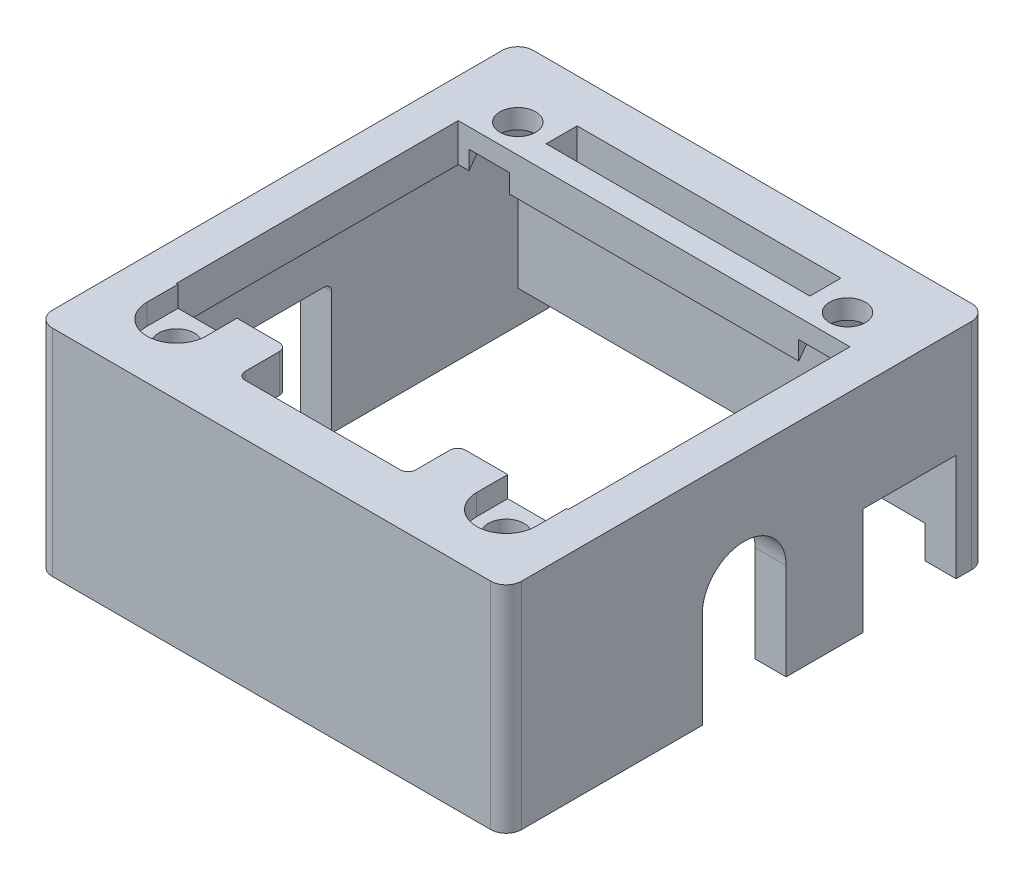
from build123d import *

# Parameters (mm, degrees)
SKETCH_1_W           = 30.25
SKETCH_1_H           = 31
SKETCH_1_W_2         = 26.25
SKETCH_1_H_2         = 27
EXTRUDE_1_DEPTH      = 11.42
SKETCH_2_W           = 30.25
SKETCH_2_H           = 31
EXTRUDE_2_DEPTH      = 2.45
SKETCH_3_W           = 25.25
SKETCH_3_H           = 18.16
CUT_EXTRUDE_1_DEPTH  = 2.45
SKETCH_4_R           = 1.15
CUT_EXTRUDE_3_DEPTH  = 2.45
CUT_EXTRUDE_4_DEPTH  = 1.2
SKETCH_6_R           = 1.9
CUT_EXTRUDE_5_DEPTH  = 1.35
SKETCH_7_W           = 11
SKETCH_7_H           = 3.2
CUT_EXTRUDE_7_DEPTH  = 2.45
SKETCH_8_W           = 17
SKETCH_8_H           = 2
CUT_EXTRUDE_9_DEPTH  = 2.45
FILLET_1_R           = 1
SKETCH_12_W          = 6
SKETCH_12_H          = 6.9
CUT_EXTRUDE_10_DEPTH = 2
CUT_EXTRUDE_11_DEPTH = 2
SKETCH_15_W          = 9.5
SKETCH_15_H          = 8.4
CUT_EXTRUDE_12_DEPTH = 2
FILLET_2_R           = 0.5
FILLET_3_R           = 0.5
CUT_EXTRUDE_19_REACH = 36.644
SKETCH_17_W          = 26.25
SKETCH_17_H          = 2.1
SKETCH_18_W          = 3.8
SKETCH_18_H          = 2
CUT_EXTRUDE_20_DEPTH = 1.35


with BuildPart() as part:
    # 草图1 → 凸台-拉伸1 (new body)
    with BuildSketch(Plane(origin=(0, 0, 0), x_dir=(1, 0, 0), z_dir=(0, 1, 0))):
        Rectangle(SKETCH_1_W, SKETCH_1_H)
        Rectangle(SKETCH_1_W_2, SKETCH_1_H_2, mode=Mode.SUBTRACT)
    extrude(amount=-EXTRUDE_1_DEPTH)

    # 草图2 → 凸台-拉伸2 (add)
    with BuildSketch(Plane(origin=(0, 0, 0), x_dir=(1, 0, 0), z_dir=(0, 1, 0))):
        Rectangle(SKETCH_2_W, SKETCH_2_H)
    extrude(amount=EXTRUDE_2_DEPTH)

    # 草图3 → 切除-拉伸1 (cut)
    with BuildSketch(Plane(origin=(0, 0, 0), x_dir=(1, 0, 0), z_dir=(0, 1, 0))):
        with Locations((0, 0.08)):
            Rectangle(SKETCH_3_W, SKETCH_3_H)
    extrude(amount=CUT_EXTRUDE_1_DEPTH, mode=Mode.SUBTRACT)

    # 草图4 → 切除-拉伸3 (cut)
    with BuildSketch(Plane(origin=(0, 0, 0), x_dir=(1, 0, 0), z_dir=(0, 1, 0))):
        with Locations(Location((-10.625, 11, 0), (0, 0, 270))):
            Circle(SKETCH_4_R)
        with Locations(Location((-10.625, -11, 0), (0, 0, 90))):
            Circle(SKETCH_4_R)
        with Locations(Location((10.625, 11, 0), (0, 0, 90))):
            Circle(SKETCH_4_R)
        with Locations(Location((10.625, -11, 0), (0, 0, 270))):
            Circle(SKETCH_4_R)
    extrude(amount=CUT_EXTRUDE_3_DEPTH, mode=Mode.SUBTRACT)

    # 草图5 → 切除-拉伸4 (cut)
    with BuildSketch(Plane(origin=(0, 0, 0), x_dir=(1, 0, 0), z_dir=(0, 1, 0))):
        Polygon((-9.441431948, 8.95), (-8.257863896, 11), (-9.441431948, 13.05), (-11.808568052, 13.05), (-12.992136104, 11), (-11.808568052, 8.95), align=None)
        Polygon((11.808568052, 8.95), (9.441431948, 8.95), (8.257863896, 11), (9.441431948, 13.05), (11.808568052, 13.05), (12.992136104, 11), align=None)
    extrude(amount=CUT_EXTRUDE_4_DEPTH, mode=Mode.SUBTRACT)

    # 草图6 → 切除-拉伸5 (cut)
    with BuildSketch(Plane(origin=(0, 2.45, 0), x_dir=(1, 0, 0), z_dir=(0, 1, 0))):
        with Locations(Location((-10.625, -11, 0), (0, 0, 270))):
            Circle(SKETCH_6_R)
        with Locations(Location((10.625, -11, 0), (0, 0, 270))):
            Circle(SKETCH_6_R)
    extrude(amount=-CUT_EXTRUDE_5_DEPTH, mode=Mode.SUBTRACT)

    # 草图7 → 切除-拉伸7 (cut)
    with BuildSketch(Plane(origin=(0, 0, 0), x_dir=(1, 0, 0), z_dir=(0, 1, 0))):
        with Locations((0, -10.6)):
            Rectangle(SKETCH_7_W, SKETCH_7_H)
    extrude(amount=CUT_EXTRUDE_7_DEPTH, mode=Mode.SUBTRACT)

    # 草图8 → 切除-拉伸9 (cut)
    with BuildSketch(Plane(origin=(0, 0, 0), x_dir=(1, 0, 0), z_dir=(0, 1, 0))):
        with Locations((0, 11.7)):
            Rectangle(SKETCH_8_W, SKETCH_8_H)
    extrude(amount=CUT_EXTRUDE_9_DEPTH, mode=Mode.SUBTRACT)

    # 圆角1
    fillet_1_edges = [part.edges().sort_by_distance(p)[0] for p in [
        (-15.125, -4.485, -15.5),
        (15.125, -4.485, -15.5),
        (15.125, -4.485, 15.5),
        (-15.125, -4.485, 15.5),
    ]]
    fillet(fillet_1_edges, radius=FILLET_1_R)

    # 草图12 → 切除-拉伸10 (cut)
    with BuildSketch(Plane.ZY.offset(-13.125)):
        with Locations((-10.5, -7.97)):
            Rectangle(SKETCH_12_W, SKETCH_12_H)
    extrude(amount=-CUT_EXTRUDE_10_DEPTH, mode=Mode.SUBTRACT)

    # 草图14 → 切除-拉伸11 (cut)
    with BuildSketch(Plane.ZY.offset(-13.125)):
        with BuildLine():
            Line((2.857, -11.42), (2.857, -5.2))
            ThreePointArc((2.857, -5.2), (0.157, -2.5), (-2.543, -5.2))
            Line((-2.543, -5.2), (-2.543, -11.42))
            Line((-2.543, -11.42), (2.857, -11.42))
        make_face()
    extrude(amount=-CUT_EXTRUDE_11_DEPTH, mode=Mode.SUBTRACT)

    # 草图15 → 切除-拉伸12 (cut)
    with BuildSketch(Plane(origin=(-13.125, 0, 0), x_dir=(0, 0, -1), z_dir=(1, 0, 0))):
        with Locations((-3.25, -7.22)):
            Rectangle(SKETCH_15_W, SKETCH_15_H)
    extrude(amount=-CUT_EXTRUDE_12_DEPTH, mode=Mode.SUBTRACT)

    # 圆角2
    fillet_2_edges = [part.edges().sort_by_distance(p)[0] for p in [
        (-14.125, -3.02, 8),
        (-14.125, -3.02, -1.5),
    ]]
    fillet(fillet_2_edges, radius=FILLET_2_R)

    # 圆角3
    fillet_3_edges = [part.edges().sort_by_distance(p)[0] for p in [
        (-5.5, 1.225, 12.2),
        (5.5, 1.225, 12.2),
        (5.5, 1.225, 9),
        (-5.5, 1.225, 9),
    ]]
    fillet(fillet_3_edges, radius=FILLET_3_R)

    # 草图17 → 切除-拉伸19 (cut, up to next)
    with BuildSketch(Plane.XY.offset(-13.5), mode=Mode.PRIVATE) as cut_extrude_19_sk1:
        with Locations((0, -10.37)):
            Rectangle(SKETCH_17_W, SKETCH_17_H)
    cut_extrude_19_tool1 = extrude(cut_extrude_19_sk1.sketch, amount=-CUT_EXTRUDE_19_REACH, mode=Mode.PRIVATE) & part.part
    add(cut_extrude_19_tool1.solids().sort_by_distance((0, -10.37, -13.5))[0], mode=Mode.SUBTRACT)

    # 草图18 → 切除-拉伸20 (cut)
    with BuildSketch(Plane(origin=(0, 2.45, 0), x_dir=(1, 0, 0), z_dir=(0, 1, 0))):
        with Locations((-10.625, -10)):
            Rectangle(SKETCH_18_W, SKETCH_18_H)
        with Locations((10.625, -10)):
            Rectangle(SKETCH_18_W, SKETCH_18_H)
    extrude(amount=-CUT_EXTRUDE_20_DEPTH, mode=Mode.SUBTRACT)


solid = part.part
